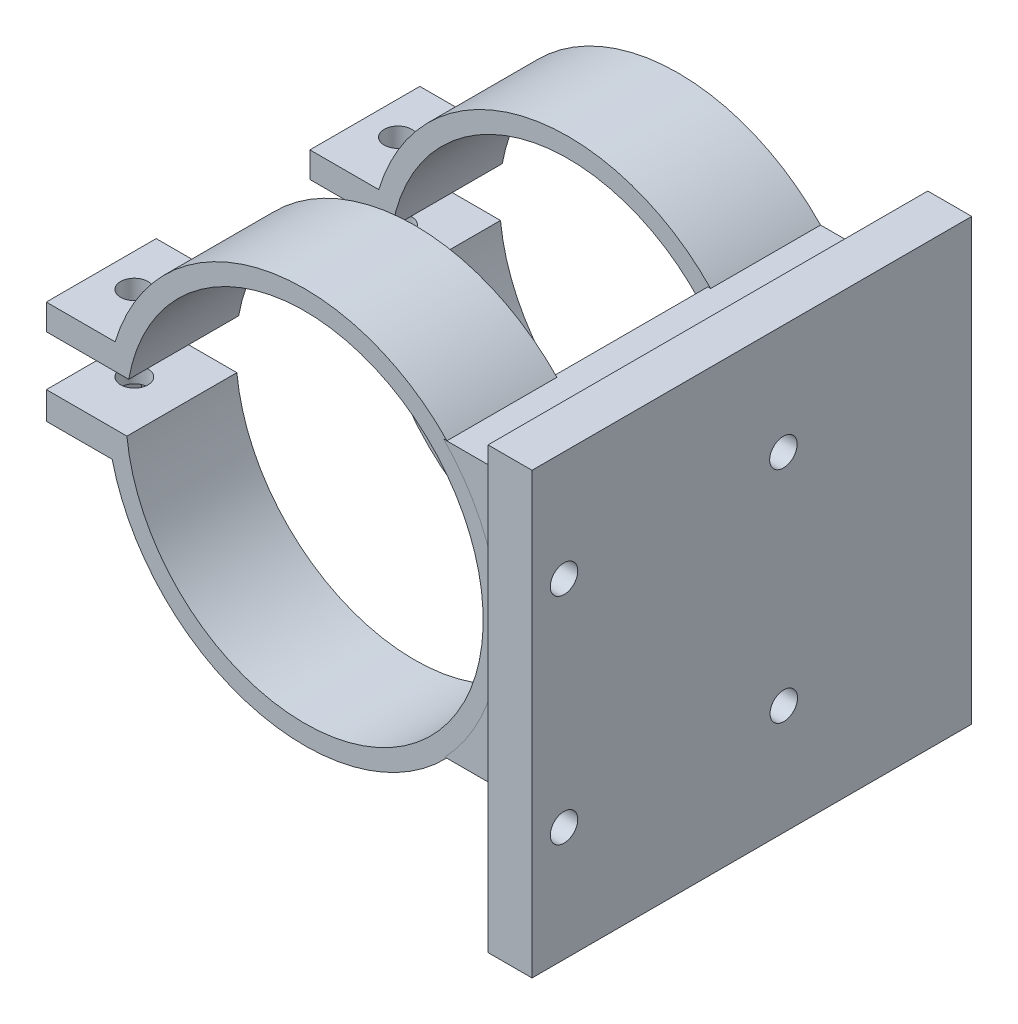
from build123d import *

# Parameters (mm, degrees)
BOSS_EXTRU_2_DEPTH         = 20
BOSS_EXTRU_4_DEPTH         = 2.2401
BOSS_EXTRU_4_DEPTH_BACK    = 20
ESQUISSE3_R                = 2.5
BOSS_EXTRU_7_DEPTH         = 6.805036811
BOSS_EXTRU_7_DEPTH_BACK    = 0.2
ESQUISSE13_W               = 8
ESQUISSE13_H               = 80
BOSS_EXTRU_9_DEPTH         = 80
BOSS_EXTRU_11_DEPTH        = 40
BOSS_EXTRU_11_DEPTH_BACK   = 3.5598
ESQUISSE16_R               = 2.5
BOSS_EXTRU_11_2_DEPTH      = 40
BOSS_EXTRU_11_2_DEPTH_BACK = 3.5598
BOSS_EXTRU_11_3_DEPTH      = 40
BOSS_EXTRU_11_3_DEPTH_BACK = 3.5598
BOSS_EXTRU_11_4_DEPTH      = 40
BOSS_EXTRU_11_4_DEPTH_BACK = 3.5598
BOSS_EXTRU_12_DEPTH        = 68
ESQUISSE19_R               = 5.214324904
BOSS_EXTRU_15_DEPTH        = 21.55
ESQUISSE19_R_2             = 5
BOSS_EXTRU_15_2_DEPTH      = 21.55


with BuildPart() as part:
    # Esquisse1 → Boss.-Extru.2 (new body)
    with BuildSketch(Plane.XY):
        with BuildLine():
            Line((-71.273833315, 9.654910047), (-56.622475708, 9.654910047))
            ThreePointArc((-56.622475708, 9.654910047), (8.178325953, 11.885050452), (-56.29470269, 18.765893404))
            Line((-56.29470269, 18.765893404), (-71.29470269, 18.765893404))
            Line((-71.29470269, 18.765893404), (-71.29470269, 23.440192667))
            Line((-71.29470269, 23.440192667), (-58.769730896, 23.440192667))
            ThreePointArc((-58.769730896, 23.440192667), (11.684606541, 12.02375525), (-59.307286147, 4.654910047))
            Line((-59.307286147, 4.654910047), (-71.273833315, 4.654910047))
            Line((-71.273833315, 4.654910047), (-71.273833315, 9.654910047))
        make_face()
    extrude(amount=BOSS_EXTRU_2_DEPTH)


with BuildPart() as body_2:
    # Esquisse3 → Boss.-Extru.4 (new, two sides: drawn at the far end of the back side and taken through both)
    with BuildSketch(Plane(origin=(11.50882306, 4.654910047, -20.756809104), x_dir=(-1, 0, 0), z_dir=(0, -1, 0)).offset(-BOSS_EXTRU_4_DEPTH_BACK)):
        with Locations(Location((76.783055813, -30.756809104, 0), (0, 0, 90))):
            Circle(ESQUISSE3_R)
    extrude(amount=BOSS_EXTRU_4_DEPTH + BOSS_EXTRU_4_DEPTH_BACK)


with BuildPart() as body_3:
    # Esquisse8 → Boss.-Extru.7 (new, two sides: drawn at the far end of the back side and taken through both)
    with BuildSketch(Plane(origin=(38.166060495, 0, 0), x_dir=(1, 0, 0), z_dir=(0, 1, 0)).offset(-BOSS_EXTRU_7_DEPTH_BACK)):
        Polygon((-101.475254656, -13.421592672), (-99.52284996, -9.930444451), (-101.570070661, -6.494038275), (-105.569696057, -6.548780321), (-107.522100752, -10.039928543), (-105.474880052, -13.476334718), align=None)
    extrude(amount=BOSS_EXTRU_7_DEPTH + BOSS_EXTRU_7_DEPTH_BACK)


with BuildPart() as part_1:
    add(part.part)

    # Combiner2: cut body 2, body 3
    add(body_2.part, mode=Mode.SUBTRACT)
    add(body_3.part, mode=Mode.SUBTRACT)


with BuildPart() as body_2_2:
    # Corps-Déplacer/Copier2: copy of part
    add(part_1.part.moved(Location((0, 0, 72.964959744))))


with BuildPart() as body_3_2:
    # Esquisse13 → Boss.-Extru.9 (new body)
    with BuildSketch(Plane.XY):
        with Locations((26.041295444, 19.15878473)):
            Rectangle(ESQUISSE13_W, ESQUISSE13_H)
    extrude(amount=BOSS_EXTRU_9_DEPTH)


with BuildPart() as body_2_2_1:
    # Corps-Déplacer/Copier3: moved
    add(body_2_2.part.moved(Location((0, 0, -25))))


with BuildPart() as body_4:
    # Esquisse16 → Boss.-Extru.11 (new, two sides: drawn at the far end of the back side and taken through both)
    with BuildSketch(Plane(origin=(0, 0, 0), x_dir=(0, 0, -1), z_dir=(1, 0, 0)).offset(-BOSS_EXTRU_11_DEPTH_BACK)):
        with Locations((-34.262679566, 39.15878473)):
            Circle(ESQUISSE16_R)
    extrude(amount=BOSS_EXTRU_11_DEPTH + BOSS_EXTRU_11_DEPTH_BACK)


with BuildPart() as body_5:
    # Esquisse16 → Boss.-Extru.11 2 (new, two sides: drawn at the far end of the back side and taken through both)
    with BuildSketch(Plane(origin=(0, 0, 0), x_dir=(0, 0, -1), z_dir=(1, 0, 0)).offset(-BOSS_EXTRU_11_2_DEPTH_BACK)):
        with Locations((-34.195620058, -0.841159058)):
            Circle(ESQUISSE16_R)
    extrude(amount=BOSS_EXTRU_11_2_DEPTH + BOSS_EXTRU_11_2_DEPTH_BACK)


with BuildPart() as body_6:
    # Esquisse16 → Boss.-Extru.11 3 (new, two sides: drawn at the far end of the back side and taken through both)
    with BuildSketch(Plane(origin=(0, 0, 0), x_dir=(0, 0, -1), z_dir=(1, 0, 0)).offset(-BOSS_EXTRU_11_3_DEPTH_BACK)):
        with Locations((-74.176398553, 0)):
            Circle(ESQUISSE16_R)
    extrude(amount=BOSS_EXTRU_11_3_DEPTH + BOSS_EXTRU_11_3_DEPTH_BACK)


with BuildPart() as body_7:
    # Esquisse16 → Boss.-Extru.11 4 (new, two sides: drawn at the far end of the back side and taken through both)
    with BuildSketch(Plane(origin=(0, 0, 0), x_dir=(0, 0, -1), z_dir=(1, 0, 0)).offset(-BOSS_EXTRU_11_4_DEPTH_BACK)):
        with Locations((-74.176398553, 39.15878473)):
            Circle(ESQUISSE16_R)
    extrude(amount=BOSS_EXTRU_11_4_DEPTH + BOSS_EXTRU_11_4_DEPTH_BACK)


with BuildPart() as body_3_2_1:
    add(body_3_2.part)

    # Combiner3: cut body 7, body 4, body 6, body 5
    add(body_7.part, mode=Mode.SUBTRACT)
    add(body_4.part, mode=Mode.SUBTRACT)
    add(body_6.part, mode=Mode.SUBTRACT)
    add(body_5.part, mode=Mode.SUBTRACT)


with BuildPart() as part_2:
    add(part_1.part)

    add(body_2_2_1.part)  # Boss.-Extru.12 merges body 2 2
    # Esquisse17 → Boss.-Extru.12 (add)
    with BuildSketch(Plane.XY):
        with BuildLine():
            Line((21.259619395, 38.041540738), (1.098292972, 38.041540738))
            Line((1.098292972, 38.041540738), (1.098292972, 37.989779899))
            ThreePointArc((1.098292972, 37.989779899), (11.250408812, 13.048189822), (1.259619395, -11.958459262))
            Line((1.259619395, -11.958459262), (21.259619395, -11.958459262))
            Line((21.259619395, -11.958459262), (21.259619395, 38.041540738))
        make_face()
    extrude(amount=BOSS_EXTRU_12_DEPTH)


with BuildPart() as body_3_2_2:
    # Corps-Déplacer/Copier4: moved
    add(body_3_2_1.part.moved(Location((0, -10, 0))))


with BuildPart() as body_3_2_3:
    # Corps-Déplacer/Copier5: moved
    add(body_3_2_2.part.moved(Location((0, 5, 0))))


with BuildPart() as body_3_2_4:
    # Corps-Déplacer/Copier6: moved
    add(body_3_2_3.part.moved(Location((0, -1, 0))))


with BuildPart() as body_3_2_5:
    # Corps-Déplacer/Copier7: moved
    add(body_3_2_4.part.moved(Location((57.599184588, 0, 0))))


with BuildPart() as part_3:
    # Corps-Déplacer/Copier8: moved
    add(part_2.part.moved(Location((-92, 0, 0))))


with BuildPart() as body_3_3:
    # Esquisse19 → Boss.-Extru.15 (new body)
    with BuildSketch(Plane(origin=(0, 0, 0), x_dir=(0, 0, -1), z_dir=(1, 0, 0))):
        with Locations((-34.195620058, 32.532899017)):
            Circle(ESQUISSE19_R)
    extrude(amount=BOSS_EXTRU_15_DEPTH)


with BuildPart() as body_4_2:
    # Esquisse19 → Boss.-Extru.15 2 (new body)
    with BuildSketch(Plane(origin=(0, 0, 0), x_dir=(0, 0, -1), z_dir=(1, 0, 0))):
        with Locations((-34.195620058, -6.841159058)):
            Circle(ESQUISSE19_R_2)
    extrude(amount=BOSS_EXTRU_15_2_DEPTH)


with BuildPart() as part_4:
    # Corps-Déplacer/Copier9: moved
    add(part_3.part.moved(Location((91.524740037, 0, 0))))

    # Combiner6: cut body 3 3, body 4 2
    add(body_3_3.part, mode=Mode.SUBTRACT)
    add(body_4_2.part, mode=Mode.SUBTRACT)


with BuildPart() as body_3_2_6:
    # Corps-Déplacer/Copier12: moved
    add(body_3_2_5.part.moved(Location((-59, 0, 0))))

    # Combiner7: union part
    add(part_4.part)


solid = body_3_2_6.part
